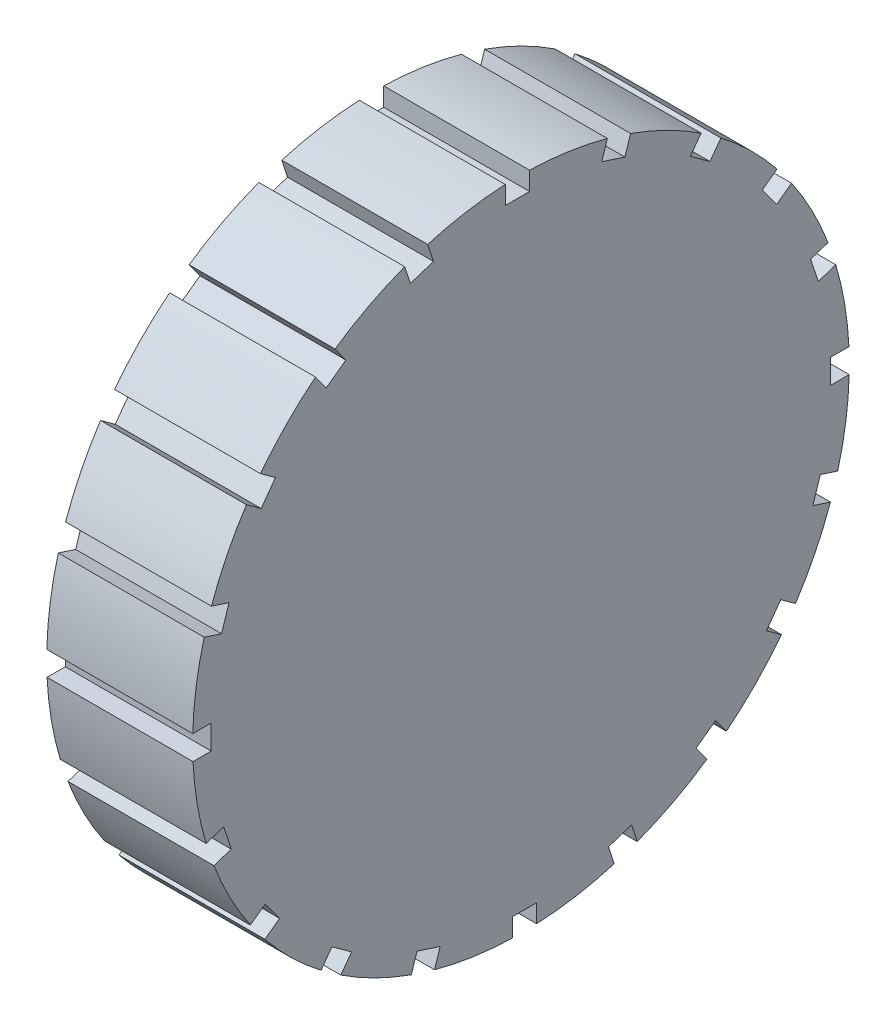
from build123d import *

# Parameters (mm, degrees)
SKETCH2_W          = 12
SKETCH2_H          = 1.5
CUT_EXTRUDE3_DEPTH = 12


with BuildPart() as part:
    # Sketch2 → Revolve1 (revolve)
    with BuildSketch(Plane.XY, mode=Mode.PRIVATE) as revolve1_sk:
        Polygon((6, 1.5), (6, 0), (18, 0), (18, 27), (6, 27), align=None)
        with Locations((0, 0.75)):
            Rectangle(SKETCH2_W, SKETCH2_H)
    revolve(revolve1_sk.sketch.rotate(Axis((6, 0, 0), (-1, 0, 0)), 90), axis=Axis((6, 0, 0), (-1, 0, 0)))

    # Sketch3 → Cut-Extrude3 (cut)
    with BuildSketch(Plane(origin=(18, 0, 0), x_dir=(0, 0, -1), z_dir=(1, 0, 0))):
        Polygon((-7.194506707, 24.442263521), (-8.742565729, 29.206625443), (-10.641704711, 28.579512114), (-9.096619739, 23.824229533), align=None)
        Polygon((0.710692324, 25.469198833), (0.710669504, 30.478752832), (-1.289307676, 30.469198833), (-1.289307676, 25.469198833), align=None)
        Polygon((8.546323839, 24.003031509), (10.094339455, 28.767407535), (8.189295778, 29.37634808), (6.644210806, 24.621065498), align=None)
        Polygon((15.54538163, 20.187280222), (18.489905129, 24.240107954), (16.866273903, 25.407935699), (13.927347641, 21.362850727), align=None)
        Polygon((21.022749156, 14.395457294), (25.075550062, 17.340017716), (23.892263624, 18.952417544), (19.847178652, 16.013491283), align=None)
        Polygon((24.442263521, 7.194506707), (29.206625443, 8.742565729), (28.579512114, 10.641704711), (23.824229533, 9.096619739), align=None)
        Polygon((25.469198833, -0.710692324), (30.478752832, -0.710669504), (30.469198833, 1.289307676), (25.469198833, 1.289307676), align=None)
        Polygon((24.003031509, -8.546323839), (28.767407535, -10.094339455), (29.37634808, -8.189295778), (24.621065498, -6.644210806), align=None)
        Polygon((20.187280222, -15.54538163), (24.240107954, -18.489905129), (25.407935699, -16.866273903), (21.362850727, -13.927347641), align=None)
        Polygon((14.395457294, -21.022749156), (17.340017716, -25.075550062), (18.952417544, -23.892263624), (16.013491283, -19.847178652), align=None)
        Polygon((7.194506707, -24.442263521), (8.742565729, -29.206625443), (10.641704711, -28.579512114), (9.096619739, -23.824229533), align=None)
        Polygon((-0.710692324, -25.469198833), (-0.710669504, -30.478752832), (1.289307676, -30.469198833), (1.289307676, -25.469198833), align=None)
        Polygon((-8.546323839, -24.003031509), (-10.094339455, -28.767407535), (-8.189295778, -29.37634808), (-6.644210806, -24.621065498), align=None)
        Polygon((-15.54538163, -20.187280222), (-18.489905129, -24.240107954), (-16.866273903, -25.407935699), (-13.927347641, -21.362850727), align=None)
        Polygon((-21.022749156, -14.395457294), (-25.075550062, -17.340017716), (-23.892263624, -18.952417544), (-19.847178652, -16.013491283), align=None)
        Polygon((-24.442263521, -7.194506707), (-29.206625443, -8.742565729), (-28.579512114, -10.641704711), (-23.824229533, -9.096619739), align=None)
        Polygon((-25.469198833, 0.710692324), (-30.478752832, 0.710669504), (-30.469198833, -1.289307676), (-25.469198833, -1.289307676), align=None)
        Polygon((-24.003031509, 8.546323839), (-28.767407535, 10.094339455), (-29.37634808, 8.189295778), (-24.621065498, 6.644210806), align=None)
        Polygon((-20.187280222, 15.54538163), (-24.240107954, 18.489905129), (-25.407935699, 16.866273903), (-21.362850727, 13.927347641), align=None)
        Polygon((-14.395457294, 21.022749156), (-17.340017716, 25.075550062), (-18.952417544, 23.892263624), (-16.013491283, 19.847178652), align=None)
    extrude(amount=-CUT_EXTRUDE3_DEPTH, mode=Mode.SUBTRACT)


solid = part.part
